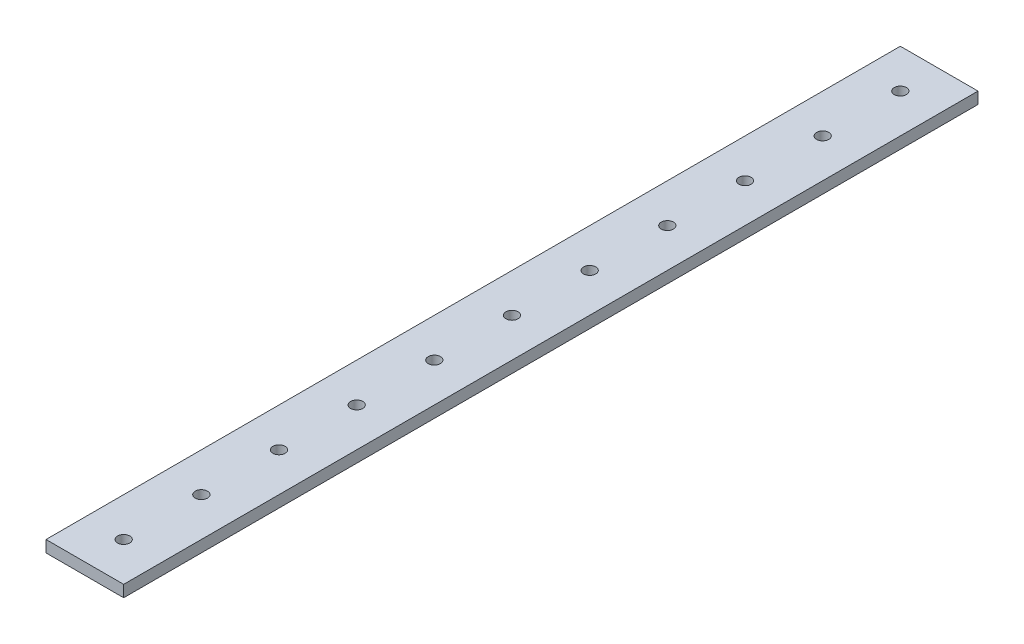
from build123d import *

# Parameters (mm, degrees)
SKETCH_1_W          = 20
SKETCH_1_H          = 3
EXTRUDE_1_DEPTH     = 220
SKETCH_2_R          = 1.575
CUT_EXTRUDE_1_DEPTH = 221.927589947


with BuildPart() as part:
    # 草图1 → 凸台-拉伸1 (new body)
    with BuildSketch(Plane.XY):
        with Locations((10, -1.5)):
            Rectangle(SKETCH_1_W, SKETCH_1_H)
    extrude(amount=EXTRUDE_1_DEPTH)

    # 草图2 → 切除-拉伸1 (cut, through all)
    with BuildSketch(Plane(origin=(0, 0, 0), x_dir=(1, 0, 0), z_dir=(0, 1, 0))):
        with Locations(Location((10, -10, 0), (0, 0, 270))):
            Circle(SKETCH_2_R)
        with Locations(Location((10, -30, 0), (0, 0, 270))):
            Circle(SKETCH_2_R)
        with Locations(Location((10, -50, 0), (0, 0, 270))):
            Circle(SKETCH_2_R)
        with Locations(Location((10, -70, 0), (0, 0, 270))):
            Circle(SKETCH_2_R)
        with Locations(Location((10, -90, 0), (0, 0, 270))):
            Circle(SKETCH_2_R)
        with Locations(Location((10, -110, 0), (0, 0, 270))):
            Circle(SKETCH_2_R)
        with Locations(Location((10, -130, 0), (0, 0, 270))):
            Circle(SKETCH_2_R)
        with Locations(Location((10, -150, 0), (0, 0, 270))):
            Circle(SKETCH_2_R)
        with Locations(Location((10, -170, 0), (0, 0, 270))):
            Circle(SKETCH_2_R)
        with Locations(Location((10, -190, 0), (0, 0, 270))):
            Circle(SKETCH_2_R)
        with Locations(Location((10, -210, 0), (0, 0, 270))):
            Circle(SKETCH_2_R)
        with Locations((10, -230)):
            Circle(SKETCH_2_R)
        with Locations((10, -250)):
            Circle(SKETCH_2_R)
        with Locations((10, -270)):
            Circle(SKETCH_2_R)
        with Locations((10, -290)):
            Circle(SKETCH_2_R)
        with Locations((10, -310)):
            Circle(SKETCH_2_R)
        with Locations((10, -330)):
            Circle(SKETCH_2_R)
        with Locations((10, -350)):
            Circle(SKETCH_2_R)
        with Locations((10, -370)):
            Circle(SKETCH_2_R)
        with Locations((10, -390)):
            Circle(SKETCH_2_R)
        with Locations((10, -410)):
            Circle(SKETCH_2_R)
        with Locations((10, -430)):
            Circle(SKETCH_2_R)
        with Locations((10, -450)):
            Circle(SKETCH_2_R)
        with Locations((10, -470)):
            Circle(SKETCH_2_R)
        with Locations((10, -490)):
            Circle(SKETCH_2_R)
        with Locations((10, -510)):
            Circle(SKETCH_2_R)
        with Locations((10, -530)):
            Circle(SKETCH_2_R)
        with Locations((10, -550)):
            Circle(SKETCH_2_R)
        with Locations((10, -570)):
            Circle(SKETCH_2_R)
        with Locations((10, -590)):
            Circle(SKETCH_2_R)
        with Locations((10, -610)):
            Circle(SKETCH_2_R)
        with Locations((10, -630)):
            Circle(SKETCH_2_R)
        with Locations((10, -650)):
            Circle(SKETCH_2_R)
    extrude(amount=-CUT_EXTRUDE_1_DEPTH, mode=Mode.SUBTRACT)


solid = part.part
